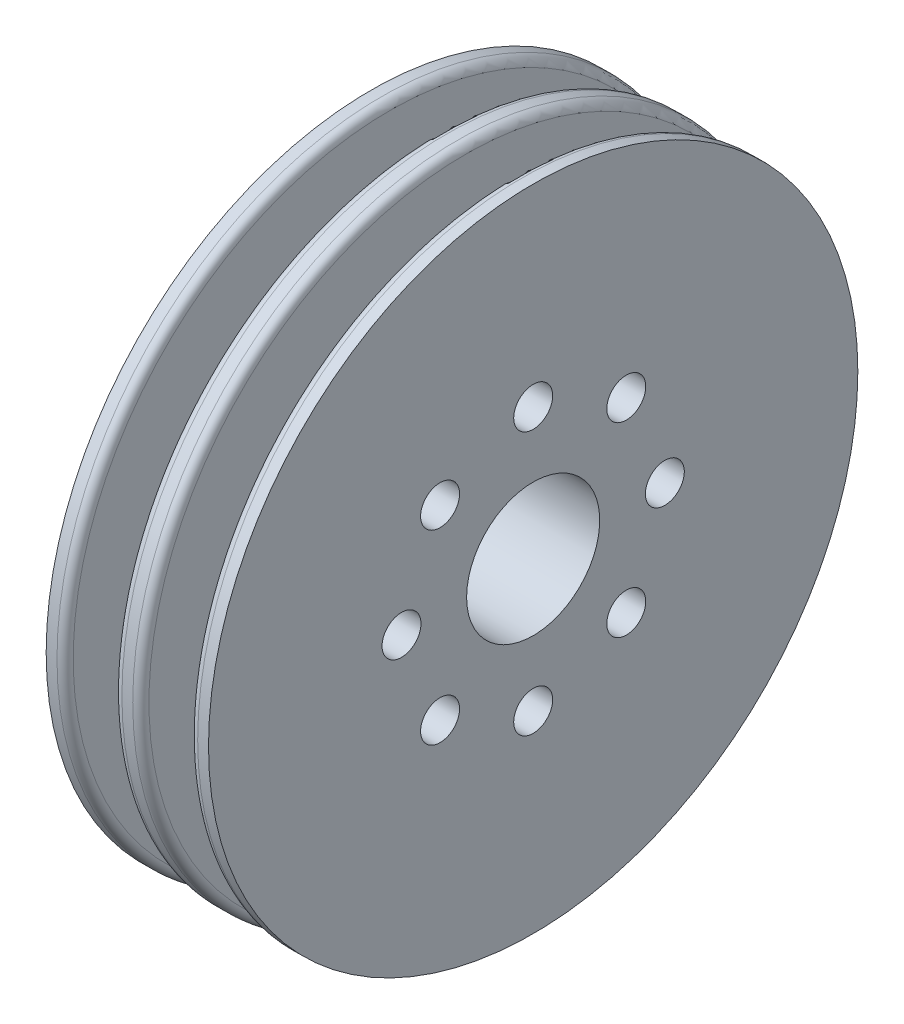
from build123d import *

# Parameters (mm, degrees)
CBORE_FOR_M2_HEX_SOCKET_HEAD_CAP_SCREW5_D           = 2.4
CBORE_FOR_M2_HEX_SOCKET_HEAD_CAP_SCREW5_CBORE_D     = 4.4
CBORE_FOR_M2_HEX_SOCKET_HEAD_CAP_SCREW5_CBORE_DEPTH = 2.4
SKETCH2_R                                           = 4.1
CUT_EXTRUDE1_DEPTH                                  = 10


with BuildPart() as part:
    # Sketch1 → Revolve4 (revolve)
    with BuildSketch(Plane(origin=(0, 0, 0), x_dir=(-1, 0, 0), z_dir=(0, 1, 0))):
        with BuildLine():
            Line((-10, 0), (0, 0))
            Line((0, 0), (0, 20))
            Line((0, 20), (-0.666666667, 20))
            ThreePointArc((-0.666666667, 20), (-1.020220057, 19.853553391), (-1.166666667, 19.5))
            Line((-1.166666667, 19.5), (-1.166666667, 15))
            ThreePointArc((-1.166666667, 15), (-2.666666667, 13.5), (-4.166666667, 15))
            Line((-4.166666667, 15), (-4.166666667, 19.5))
            ThreePointArc((-4.166666667, 19.5), (-4.313113276, 19.853553391), (-4.666666667, 20))
            Line((-4.666666667, 20), (-5.333333333, 20))
            ThreePointArc((-5.333333333, 20), (-5.686886724, 19.853553391), (-5.833333333, 19.5))
            Line((-5.833333333, 19.5), (-5.833333333, 15))
            ThreePointArc((-5.833333333, 15), (-7.333333333, 13.5), (-8.833333333, 15))
            Line((-8.833333333, 15), (-8.833333333, 19.5))
            ThreePointArc((-8.833333333, 19.5), (-8.979779943, 19.853553391), (-9.333333333, 20))
            Line((-9.333333333, 20), (-10, 20))
            Line((-10, 20), (-10, 0))
        make_face()
    revolve(axis=Axis((10, 0, 0), (-1, 0, 0)))

    # CBORE for M2 Hex Socket Head Cap Screw5 (through all)
    with Locations(Plane.ZY):
        with Locations((8.11, 0), (5.734635995, 5.734635995), (0, 8.11), (-5.734635995, 5.734635995), (-8.11, 0), (-5.734635995, -5.734635995), (0, -8.11), (5.734635995, -5.734635995)):
            CounterBoreHole(CBORE_FOR_M2_HEX_SOCKET_HEAD_CAP_SCREW5_D / 2, CBORE_FOR_M2_HEX_SOCKET_HEAD_CAP_SCREW5_CBORE_D / 2, CBORE_FOR_M2_HEX_SOCKET_HEAD_CAP_SCREW5_CBORE_DEPTH)

    # Sketch2 → Cut-Extrude1 (cut)
    with BuildSketch(Plane(origin=(0, 0, 0), x_dir=(0, -1, 0), z_dir=(-1, 0, 0))):
        Circle(SKETCH2_R)
    extrude(amount=-CUT_EXTRUDE1_DEPTH, mode=Mode.SUBTRACT)


solid = part.part
